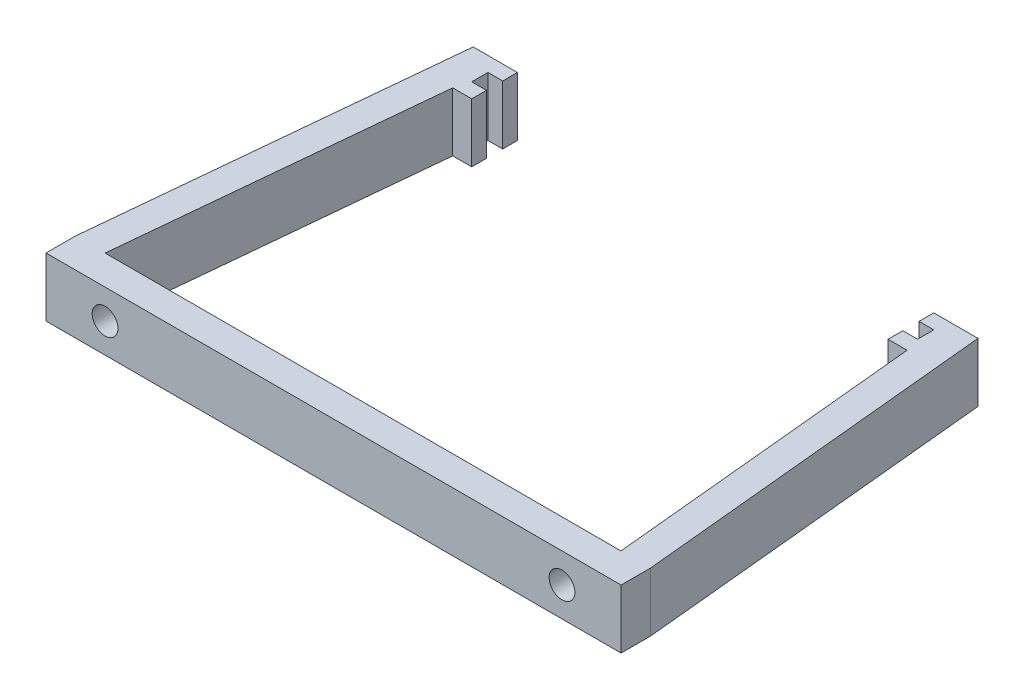
from build123d import *

# Parameters (mm, degrees)
ESBO_O1_W                = 70
ESBO_O1_H                = 8
ESBO_O1_R                = 1.75
RESSALTO_EXTRUS_O1_DEPTH = 4
RESSALTO_EXTRUS_O2_DEPTH = 8


with BuildPart() as part:
    # Esboço1 → Ressalto-extrusão1 (new body)
    with BuildSketch(Plane.XY):
        Rectangle(ESBO_O1_W, ESBO_O1_H)
        with Locations((-31, 0)):
            Circle(ESBO_O1_R, mode=Mode.SUBTRACT)
        with Locations((31, 0)):
            Circle(ESBO_O1_R, mode=Mode.SUBTRACT)
    extrude(amount=RESSALTO_EXTRUS_O1_DEPTH)

    # Esboço2 → Ressalto-extrusão2 (add)
    with BuildSketch(Plane(origin=(0, 4, 0), x_dir=(1, 0, 0), z_dir=(0, 1, 0))):
        Polygon((-35, 0), (-35, -4), (-39.018745266, -4), (-39.018745266, 0), (-34.25, 49.2), (-28.25, 49.2), (-28.25, 47.2), (-30.25, 47.2), (-30.25, 45), (-28.25, 45), (-28.25, 43), (-30.832194178, 43), align=None)
        Polygon((39.018745266, -4), (35, -4), (35, 0), (30.832194178, 43), (28.25, 43), (28.25, 45), (30.25, 45), (30.25, 47.2), (28.25, 47.2), (28.25, 49.2), (34.25, 49.2), (39.018745266, 0), align=None)
    extrude(amount=-RESSALTO_EXTRUS_O2_DEPTH)


solid = part.part
